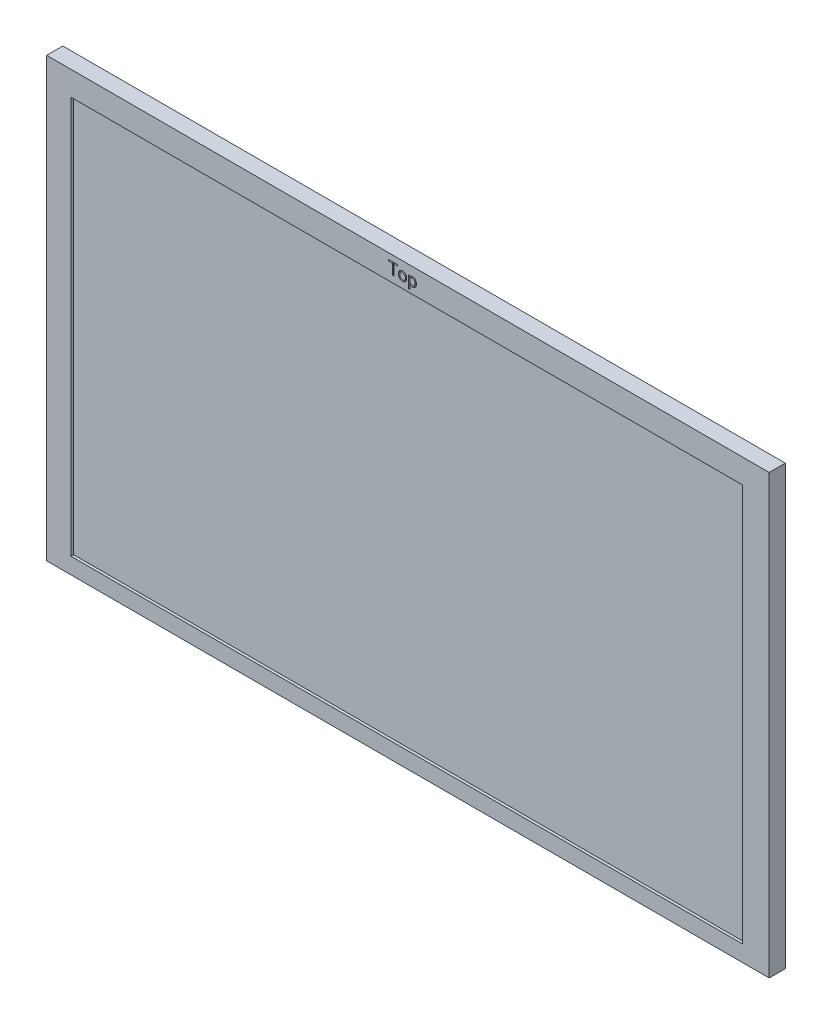
from build123d import *

# Parameters (mm, degrees)
SKETCH2_W           = 213.51875
SKETCH2_H           = 129.38125
BOSS_EXTRUDE1_DEPTH = 4.7625
SKETCH3_W           = 198.4375
SKETCH3_H           = 117.48135
CUT_EXTRUDE1_DEPTH  = 0.79375
CUT_EXTRUDE3_DEPTH  = 0.396875


with BuildPart() as part:
    # Sketch2 → Boss-Extrude1 (new body)
    with BuildSketch(Plane.XY):
        Rectangle(SKETCH2_W, SKETCH2_H)
    extrude(amount=BOSS_EXTRUDE1_DEPTH)

    # Sketch3 → Cut-Extrude1 (cut)
    with BuildSketch(Plane.XY.offset(4.7625)):
        with Locations((-0.396875, -1.18745)):
            Rectangle(SKETCH3_W, SKETCH3_H)
    extrude(amount=-CUT_EXTRUDE1_DEPTH, mode=Mode.SUBTRACT)

    # Sketch4 → Cut-Extrude3 (cut)
    # profile 1 of 3: a face of its own
    with BuildSketch(Plane.XY.offset(4.7625)):
        Polygon((-4.63223048, 59.469901373), (-4.63223048, 62.566055219), (-5.754025351, 62.566055219), (-5.754025351, 62.969901373), (-3.016845864, 62.969901373), (-3.016845864, 62.566055219), (-4.138640736, 62.566055219), (-4.138640736, 59.469901373), align=None)
    # profile 2 of 3: a face of its own
    with BuildSketch(Plane.XY.offset(4.7625)):
        with BuildLine():
            add(Edge.make_bspline(
                [(-2.79248689, 60.750149771), (-2.791578205, 60.800897237), (-2.789811205, 60.899579174), (-2.775159183, 61.043373404), (-2.749648363, 61.178276662), (-2.716012753, 61.305126295), (-2.670726881, 61.422905829), (-2.615944861, 61.532226841), (-2.551365315, 61.633070159), (-2.476556933, 61.724569563), (-2.393338991, 61.806669639), (-2.301519234, 61.878325462), (-2.200795353, 61.937902127), (-2.092996296, 61.988072111), (-1.976567117, 62.025765418), (-1.852645772, 62.053141555), (-1.720426795, 62.069238227), (-1.629603824, 62.071371863), (-1.583051794, 62.072465476)],
                knots=[0, 0, 0, 0, 1.196914274, 2.327482083, 3.404397647, 4.43282432, 5.418764687, 6.375354245, 7.312752301, 8.237468888, 9.157473639, 10.065022735, 10.97738131, 11.912247082, 12.864106972, 13.85790723, 14.902053447, 16, 16, 16, 16], degree=3))
            add(Edge.make_bspline(
                [(-1.583051794, 62.072465476), (-1.536264315, 62.071385349), (-1.445204103, 62.06928315), (-1.312543986, 62.053056639), (-1.188123706, 62.025808946), (-1.07138384, 61.988027873), (-0.96300903, 61.938777158), (-0.862422455, 61.878776011), (-0.770211387, 61.807638765), (-0.686554617, 61.725731269), (-0.611416526, 61.634778505), (-0.546507299, 61.534197111), (-0.491665134, 61.424843271), (-0.446937015, 61.306586407), (-0.411989185, 61.17981739), (-0.386755897, 61.044526267), (-0.372075867, 60.900283072), (-0.370315257, 60.801132263), (-0.369409967, 60.750149771)],
                knots=[0, 0, 0, 0, 1.101334551, 2.143474296, 3.140737505, 4.095996067, 5.026775063, 5.937380415, 6.84753682, 7.761924488, 8.688351016, 9.61932515, 10.57407649, 11.563262092, 12.59117146, 13.666017581, 14.799886337, 16, 16, 16, 16], degree=3))
            add(Edge.make_bspline(
                [(-0.369409967, 60.750149771), (-0.370323862, 60.699169633), (-0.372101206, 60.600023404), (-0.386663079, 60.455747871), (-0.412342179, 60.320409567), (-0.445896275, 60.193088388), (-0.491023209, 60.074770498), (-0.54592218, 59.965236152), (-0.610791822, 59.864410302), (-0.68486406, 59.772262043), (-0.768806115, 59.690815982), (-0.860559669, 59.619272592), (-0.960572393, 59.55882019), (-1.068753555, 59.509324251), (-1.185118759, 59.471819966), (-1.309249337, 59.444341391), (-1.441470535, 59.428260103), (-1.532293193, 59.426124301), (-1.578845063, 59.425029578)],
                knots=[0, 0, 0, 0, 1.200723947, 2.3351693, 3.410562004, 4.442847173, 5.432535798, 6.387772649, 7.323845137, 8.251527144, 9.166379799, 10.072645535, 10.986553599, 11.912797085, 12.868541418, 13.86093635, 14.903606046, 16, 16, 16, 16], degree=3))
            add(Edge.make_bspline(
                [(-1.578845063, 59.425029578), (-1.625633114, 59.42610835), (-1.716694439, 59.428207913), (-1.849346664, 59.444453118), (-1.973794955, 59.471634455), (-2.090344576, 59.50961946), (-2.199173905, 59.558061515), (-2.300066389, 59.617835027), (-2.392329616, 59.689206129), (-2.476116681, 59.770813711), (-2.550533118, 59.862569284), (-2.616192994, 59.963087848), (-2.670905054, 60.073075733), (-2.714771366, 60.191759198), (-2.750156549, 60.318789805), (-2.77502881, 60.454867311), (-2.789819387, 60.599779979), (-2.791582456, 60.699165937), (-2.79248689, 60.750149771)],
                knots=[0, 0, 0, 0, 1.099558026, 2.14001673, 3.135671288, 4.089388955, 5.016406848, 5.930261164, 6.838949427, 7.751862128, 8.673312982, 9.610384136, 10.568505676, 11.554153401, 12.580404683, 13.664317512, 14.801822199, 16, 16, 16, 16], degree=3))
        make_face()
        with BuildLine():
            add(Edge.make_bspline(
                [(-2.388640736, 60.750149771), (-2.387959908, 60.712264961), (-2.386633698, 60.638467676), (-2.376600365, 60.531217591), (-2.361149038, 60.430731092), (-2.337443343, 60.337341208), (-2.308758543, 60.250354411), (-2.271940767, 60.170609013), (-2.228889742, 60.0978206), (-2.179985721, 60.031604087), (-2.124234939, 59.972870785), (-2.062198873, 59.922506988), (-1.995266582, 59.879020166), (-1.921928137, 59.844692485), (-1.843458359, 59.817438013), (-1.759171595, 59.797532027), (-1.669339557, 59.786696766), (-1.607618275, 59.784915344), (-1.576040576, 59.784003937)],
                knots=[0, 0, 0, 0, 1.265573944, 2.465260404, 3.596221837, 4.658661206, 5.680944264, 6.652243434, 7.586979177, 8.502136788, 9.396879393, 10.284712685, 11.166274381, 12.056918907, 12.982971438, 13.937554479, 14.944816399, 16, 16, 16, 16], degree=3))
            add(Edge.make_bspline(
                [(-1.576040576, 59.784003937), (-1.544458435, 59.78488517), (-1.483192227, 59.786594675), (-1.393879021, 59.797726461), (-1.310402946, 59.817170135), (-1.232761752, 59.844860751), (-1.16032154, 59.879042833), (-1.094115567, 59.922299009), (-1.033411395, 59.973144444), (-0.978362557, 60.03160071), (-0.930195697, 60.097857917), (-0.887856886, 60.170643542), (-0.851698494, 60.250382649), (-0.823909465, 60.337470444), (-0.800048463, 60.430719066), (-0.784380965, 60.53118162), (-0.775511189, 60.638509181), (-0.774021226, 60.712272073), (-0.773256121, 60.750149771)],
                knots=[0, 0, 0, 0, 1.06023494, 2.056750171, 3.01590296, 3.931584229, 4.81941384, 5.698603924, 6.578598823, 7.472233562, 8.387107767, 9.322344576, 10.295039765, 11.319726606, 12.387252049, 13.523627582, 14.728367543, 16, 16, 16, 16], degree=3))
            add(Edge.make_bspline(
                [(-0.773256121, 60.750149771), (-0.774023107, 60.787793343), (-0.775516497, 60.861088743), (-0.784356575, 60.967724698), (-0.800157471, 61.067688682), (-0.823764819, 61.160537953), (-0.851847182, 61.247300706), (-0.887876937, 61.326829981), (-0.9299744, 61.399568559), (-0.978602635, 61.465251181), (-1.033389223, 61.523656213), (-1.094096478, 61.574544534), (-1.160506136, 61.617600749), (-1.232563521, 61.652810586), (-1.310431991, 61.680264923), (-1.393870797, 61.69978558), (-1.483194472, 61.710895742), (-1.544459198, 61.712608306), (-1.576040576, 61.713491117)],
                knots=[0, 0, 0, 0, 1.266460929, 2.465912656, 3.596927535, 4.666708805, 5.686098986, 6.660849613, 7.598062705, 8.508543896, 9.404067007, 10.285921455, 11.166969388, 12.060107797, 12.977724026, 13.938903635, 14.937524639, 16, 16, 16, 16], degree=3))
            add(Edge.make_bspline(
                [(-1.576040576, 61.713491117), (-1.607850634, 61.71257664), (-1.670035121, 61.710788958), (-1.760579317, 61.699992192), (-1.84500204, 61.680065516), (-1.923993062, 61.653518347), (-1.997045134, 61.618496995), (-2.064016924, 61.575181772), (-2.125934421, 61.525143359), (-2.181085012, 61.466605318), (-2.230647844, 61.401224616), (-2.272418861, 61.328023787), (-2.309556176, 61.248905214), (-2.337342275, 61.161906348), (-2.361203753, 61.06888629), (-2.376533384, 60.968604208), (-2.386670296, 60.861603028), (-2.387970927, 60.788035916), (-2.388640736, 60.750149771)],
                knots=[0, 0, 0, 0, 1.06399666, 2.079973764, 3.043075612, 3.960071159, 4.861986994, 5.744388166, 6.622069095, 7.517663727, 8.427436091, 9.359103441, 10.331327539, 11.344685715, 12.408136801, 13.540175203, 14.733220901, 16, 16, 16, 16], degree=3))
        make_face(mode=Mode.SUBTRACT)
    # profile 3 of 3: a face of its own
    with BuildSketch(Plane.XY.offset(4.7625)):
        with BuildLine():
            Line((0.169051572, 58.437850091), (0.169051572, 61.982721886))
            Line((0.169051572, 61.982721886), (0.587621283, 61.982721886))
            Line((0.587621283, 61.982721886), (0.587621283, 61.656700251))
            add(Edge.make_bspline(
                [(0.587621283, 61.656700251), (0.61369406, 61.69081623), (0.664381541, 61.757140314), (0.751614674, 61.842383613), (0.841770285, 61.915490541), (0.938480214, 61.973772192), (1.042478478, 62.018587035), (1.155179942, 62.049965098), (1.276871496, 62.069095469), (1.361120173, 62.071321292), (1.404428174, 62.072465476)],
                knots=[0, 0, 0, 0, 1.076434714, 2.092671812, 3.052758584, 3.984322981, 4.917087076, 5.886412009, 6.913510878, 8, 8, 8, 8], degree=3))
            add(Edge.make_bspline(
                [(1.404428174, 62.072465476), (1.44515269, 62.071437018), (1.524860484, 62.069424077), (1.641215281, 62.052226052), (1.751435062, 62.024104725), (1.855509097, 61.985251309), (1.952399762, 61.933695326), (2.04377989, 61.872684352), (2.128112196, 61.799019056), (2.205573735, 61.714869217), (2.275841715, 61.621918904), (2.336077185, 61.519950329), (2.388197287, 61.411274987), (2.430534283, 61.294585136), (2.46230176, 61.170262485), (2.485410381, 61.038307847), (2.499552728, 60.898861089), (2.501426927, 60.803234843), (2.502384905, 60.754356501)],
                knots=[0, 0, 0, 0, 1.011162453, 1.979091126, 2.913990018, 3.832598199, 4.731046524, 5.634301871, 6.556132734, 7.505074365, 8.471051356, 9.444725082, 10.441808549, 11.461020926, 12.522664527, 13.625000458, 14.78604417, 16, 16, 16, 16], degree=3))
            add(Edge.make_bspline(
                [(2.502384905, 60.754356501), (2.501411838, 60.70501291), (2.499507757, 60.608458139), (2.485564364, 60.467547483), (2.461745582, 60.334411434), (2.42870554, 60.208960242), (2.387079829, 60.090831526), (2.334877881, 59.980654694), (2.272851514, 59.878629905), (2.202353058, 59.784716668), (2.12367311, 59.700535506), (2.038944857, 59.626501968), (1.947622042, 59.564108076), (1.850011627, 59.513537479), (1.746543403, 59.472992875), (1.636266375, 59.445370508), (1.520195197, 59.428079109), (1.440715292, 59.426058864), (1.400221443, 59.425029578)],
                knots=[0, 0, 0, 0, 1.218340449, 2.384029586, 3.492247427, 4.554682384, 5.584178539, 6.580599608, 7.559435147, 8.527803385, 9.475083413, 10.399624978, 11.300799129, 12.199067542, 13.10893983, 14.038331647, 15.000558682, 16, 16, 16, 16], degree=3))
            add(Edge.make_bspline(
                [(1.400221443, 59.425029578), (1.357402653, 59.426074195), (1.273987755, 59.428109204), (1.152801706, 59.444827197), (1.039951161, 59.474015207), (0.934119413, 59.512751659), (0.836831182, 59.565584747), (0.745968713, 59.629232604), (0.662097236, 59.705333806), (0.612701667, 59.763556303), (0.587621283, 59.793118521)],
                knots=[0, 0, 0, 0, 1.109553829, 2.161511747, 3.162001952, 4.126186781, 5.074699003, 6.022514671, 6.995940494, 8, 8, 8, 8], degree=3))
            Line((0.587621283, 59.793118521), (0.587621283, 58.437850091))
            Line((0.587621283, 58.437850091), (0.169051572, 58.437850091))
        make_face()
        with BuildLine():
            add(Edge.make_bspline(
                [(0.572897725, 60.731219482), (0.573331403, 60.693103135), (0.574173497, 60.619090757), (0.583636099, 60.511884386), (0.59784196, 60.411738281), (0.619072067, 60.318998152), (0.645195355, 60.233096949), (0.678296966, 60.154954245), (0.71698589, 60.084032973), (0.761843316, 60.02041522), (0.813611735, 59.964759048), (0.870559999, 59.915948848), (0.933650261, 59.874780812), (1.003124571, 59.841841675), (1.078437203, 59.816031042), (1.159431578, 59.797098563), (1.246349695, 59.785695643), (1.306235512, 59.784579544), (1.337120482, 59.784003937)],
                knots=[0, 0, 0, 0, 1.314410342, 2.552254914, 3.709429653, 4.800675934, 5.830775327, 6.802504949, 7.722533916, 8.612803104, 9.479923327, 10.337699958, 11.194073846, 12.070252639, 12.982941539, 13.935215687, 14.935126777, 16, 16, 16, 16], degree=3))
            add(Edge.make_bspline(
                [(1.337120482, 59.784003937), (1.366841088, 59.784828903), (1.424661527, 59.786433847), (1.508638993, 59.798378109), (1.587285253, 59.818670679), (1.660558283, 59.847751609), (1.729204482, 59.884082988), (1.792151034, 59.929648227), (1.849760741, 59.983144298), (1.901935739, 60.04461936), (1.948047763, 60.113744442), (1.988936475, 60.189375261), (2.022344786, 60.272371342), (2.050521986, 60.361614945), (2.072129284, 60.458036306), (2.086988521, 60.561189385), (2.09746741, 60.670942705), (2.098174753, 60.746383916), (2.098538751, 60.78520586)],
                knots=[0, 0, 0, 0, 1.001265416, 1.947928157, 2.851415982, 3.731783978, 4.598520745, 5.461816075, 6.342289734, 7.241752941, 8.172226572, 9.137636931, 10.133561233, 11.182145847, 12.288323559, 13.458870158, 14.692338022, 16, 16, 16, 16], degree=3))
            add(Edge.make_bspline(
                [(2.098538751, 60.78520586), (2.09776655, 60.820278524), (2.096260681, 60.888673649), (2.087433162, 60.988563965), (2.071344963, 61.082562096), (2.048861502, 61.170726232), (2.020401971, 61.253375361), (1.984166792, 61.329766651), (1.943202777, 61.401362232), (1.894369018, 61.465822646), (1.840665562, 61.523931248), (1.782117665, 61.575081608), (1.718626329, 61.617822176), (1.650743936, 61.653762042), (1.577293201, 61.679680815), (1.49977132, 61.699925765), (1.417351812, 61.710776633), (1.360986243, 61.712573731), (1.332212629, 61.713491117)],
                knots=[0, 0, 0, 0, 1.238131558, 2.414477677, 3.536093484, 4.600551336, 5.623305668, 6.616075714, 7.581035437, 8.529742718, 9.463737667, 10.370183786, 11.267119882, 12.160063577, 13.073502742, 14.009899177, 14.984089145, 16, 16, 16, 16], degree=3))
            add(Edge.make_bspline(
                [(1.332212629, 61.713491117), (1.302720929, 61.712680446), (1.245125021, 61.711097245), (1.161287264, 61.698831224), (1.08229618, 61.679680271), (1.008955121, 61.651312637), (0.94072032, 61.615353279), (0.87811794, 61.570682336), (0.820276956, 61.51863998), (0.768145871, 61.458511113), (0.72207883, 61.391115752), (0.681753974, 61.316930016), (0.648419256, 61.235663857), (0.619992694, 61.147915115), (0.599632048, 61.052903635), (0.584302961, 60.951528712), (0.574021187, 60.843608616), (0.573278767, 60.769338223), (0.572897725, 60.731219482)],
                knots=[0, 0, 0, 0, 1.005319481, 1.963341822, 2.883418888, 3.771458963, 4.637812856, 5.506838597, 6.387120206, 7.285294604, 8.213755546, 9.165925689, 10.159072514, 11.205047572, 12.307201963, 13.468154334, 14.700548587, 16, 16, 16, 16], degree=3))
        make_face(mode=Mode.SUBTRACT)
    extrude(amount=-CUT_EXTRUDE3_DEPTH, mode=Mode.SUBTRACT)


solid = part.part
